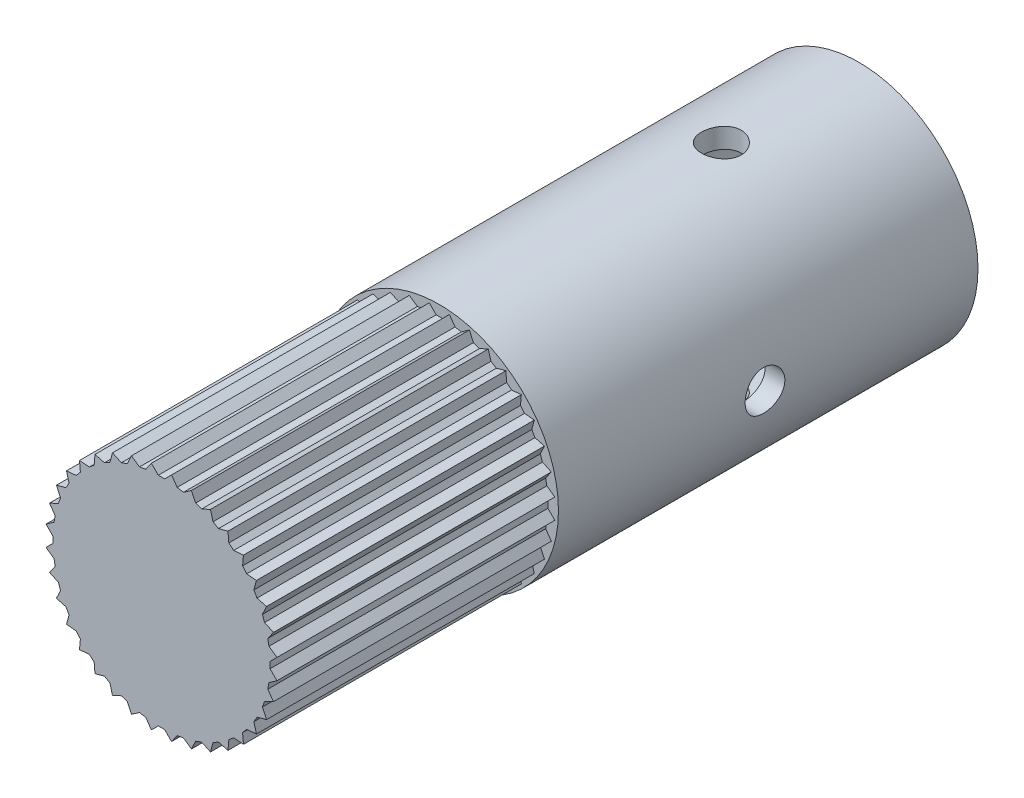
from build123d import *

# Parameters (mm, degrees)
SKETCH5_W               = 1.587499994
SKETCH5_H               = 55.780081988
CUT_EXTRUDE5_DEPTH      = 80.097038204
CUT_EXTRUDE5_DEPTH_BACK = 80.097038204
SKETCH7_R               = 1.5875
CUT_EXTRUDE6_DEPTH      = 80.097038326
CUT_EXTRUDE6_DEPTH_BACK = 80.097038326
SKETCH6_R               = 1.5875
CUT_EXTRUDE7_START      = 77.941582
SKETCH8_R               = 12.7
CUT_EXTRUDE7_DEPTH      = 22.225
SKETCH10_R              = 7.9375
BOSS_EXTRUDE1_DEPTH     = 30.380081988


with BuildPart() as part:
    # Sketch5 → Revolve2 (revolve)
    with BuildSketch(Plane(origin=(0, 0, 0), x_dir=(1, 0, 0), z_dir=(0, 1, 0)), mode=Mode.PRIVATE) as revolve2_sk:
        with Locations((8.731249997, -50.051540994)):
            Rectangle(SKETCH5_W, SKETCH5_H)
    revolve(revolve2_sk.sketch.rotate(Axis((0, 0, 0), (0, 0, 1)), 180), axis=Axis((0, 0, 0), (0, 0, 1)))

    # Sketch7 → Cut-Extrude5 (cut, two sides: drawn at the far end of the back side and taken through both)
    with BuildSketch(Plane(origin=(0, 0, 0), x_dir=(0, 0, -1), z_dir=(1, 0, 0)).offset(-CUT_EXTRUDE5_DEPTH_BACK)):
        with Locations((-39.195999993, 0)):
            Circle(SKETCH7_R)
    extrude(amount=CUT_EXTRUDE5_DEPTH + CUT_EXTRUDE5_DEPTH_BACK, mode=Mode.SUBTRACT)

    # Sketch6 → Cut-Extrude6 (cut, two sides: drawn at the far end of the back side and taken through both)
    with BuildSketch(Plane(origin=(0, 0, 0), x_dir=(1, 0, 0), z_dir=(0, 1, 0)).offset(-CUT_EXTRUDE6_DEPTH_BACK)):
        with Locations(Location((1e-09, -33.163499999, 0), (0, 0, 269.999999955))):
            Circle(SKETCH6_R)
    extrude(amount=CUT_EXTRUDE6_DEPTH + CUT_EXTRUDE6_DEPTH_BACK, mode=Mode.SUBTRACT)

    # Sketch8 → Cut-Extrude7 (cut)
    with BuildSketch(Plane.XY.offset(CUT_EXTRUDE7_START)):
        Circle(SKETCH8_R)
        Polygon((9.235721046, -0.808020891), (8.681700155, -0.254), (8.681700155, 0.254), (9.235721046, 0.808020891), (8.593912259, 1.257420242), (8.505698985, 1.75770258), (8.955098336, 2.399511367), (8.245002688, 2.730634406), (8.071256455, 3.207998257), (8.402379494, 3.918093905), (7.645572882, 4.120879625), (7.391572882, 4.56082053), (7.594358603, 5.317627141), (6.813836213, 5.385914002), (6.487300108, 5.775064579), (6.555586968, 6.555586968), (5.775064579, 6.487300108), (5.385914002, 6.813836213), (5.317627141, 7.594358603), (4.56082053, 7.391572882), (4.120879625, 7.645572882), (3.918093905, 8.402379494), (3.207998257, 8.071256455), (2.730634406, 8.245002688), (2.399511367, 8.955098336), (1.75770258, 8.505698985), (1.257420242, 8.593912259), (0.808020891, 9.235721046), (0.254, 8.681700155), (-0.254, 8.681700155), (-0.808020891, 9.235721046), (-1.257420242, 8.593912259), (-1.75770258, 8.505698985), (-2.399511367, 8.955098336), (-2.730634406, 8.245002688), (-3.207998257, 8.071256455), (-3.918093905, 8.402379494), (-4.120879625, 7.645572882), (-4.56082053, 7.391572882), (-5.317627141, 7.594358603), (-5.385914002, 6.813836213), (-5.775064579, 6.487300108), (-6.555586968, 6.555586968), (-6.487300108, 5.775064579), (-6.813836213, 5.385914002), (-7.594358603, 5.317627141), (-7.391572882, 4.56082053), (-7.645572882, 4.120879625), (-8.402379494, 3.918093905), (-8.071256455, 3.207998257), (-8.245002688, 2.730634406), (-8.955098336, 2.399511367), (-8.505698985, 1.75770258), (-8.593912259, 1.257420242), (-9.235721046, 0.808020891), (-8.681700155, 0.254), (-8.681700155, -0.254), (-9.235721046, -0.808020891), (-8.593912259, -1.257420242), (-8.505698985, -1.75770258), (-8.955098336, -2.399511367), (-8.245002688, -2.730634406), (-8.071256455, -3.207998257), (-8.402379494, -3.918093905), (-7.645572882, -4.120879625), (-7.391572882, -4.56082053), (-7.594358603, -5.317627141), (-6.813836213, -5.385914002), (-6.487300108, -5.775064579), (-6.555586968, -6.555586968), (-5.775064579, -6.487300108), (-5.385914002, -6.813836213), (-5.317627141, -7.594358603), (-4.56082053, -7.391572882), (-4.120879625, -7.645572882), (-3.918093905, -8.402379494), (-3.207998257, -8.071256455), (-2.730634406, -8.245002688), (-2.399511367, -8.955098336), (-1.75770258, -8.505698985), (-1.257420242, -8.593912259), (-0.808020891, -9.235721046), (-0.254, -8.681700155), (0.254, -8.681700155), (0.808020891, -9.235721046), (1.257420242, -8.593912259), (1.75770258, -8.505698985), (2.399511367, -8.955098336), (2.730634406, -8.245002688), (3.207998257, -8.071256455), (3.918093905, -8.402379494), (4.120879625, -7.645572882), (4.56082053, -7.391572882), (5.317627141, -7.594358603), (5.385914002, -6.813836213), (5.775064579, -6.487300108), (6.555586968, -6.555586968), (6.487300108, -5.775064579), (6.813836213, -5.385914002), (7.594358603, -5.317627141), (7.391572882, -4.56082053), (7.645572882, -4.120879625), (8.402379494, -3.918093905), (8.071256455, -3.207998257), (8.245002688, -2.730634406), (8.955098336, -2.399511367), (8.505698985, -1.75770258), (8.593912259, -1.257420242), align=None, mode=Mode.SUBTRACT)
    extrude(amount=-CUT_EXTRUDE7_DEPTH, mode=Mode.SUBTRACT)

    # Sketch10 → Boss-Extrude1 (add)
    with BuildSketch(Plane(origin=(0, 0, 47.5615), x_dir=(-1, 0, 0), z_dir=(0, 0, -1))):
        Circle(SKETCH10_R)
    extrude(amount=-BOSS_EXTRUDE1_DEPTH)


solid = part.part
